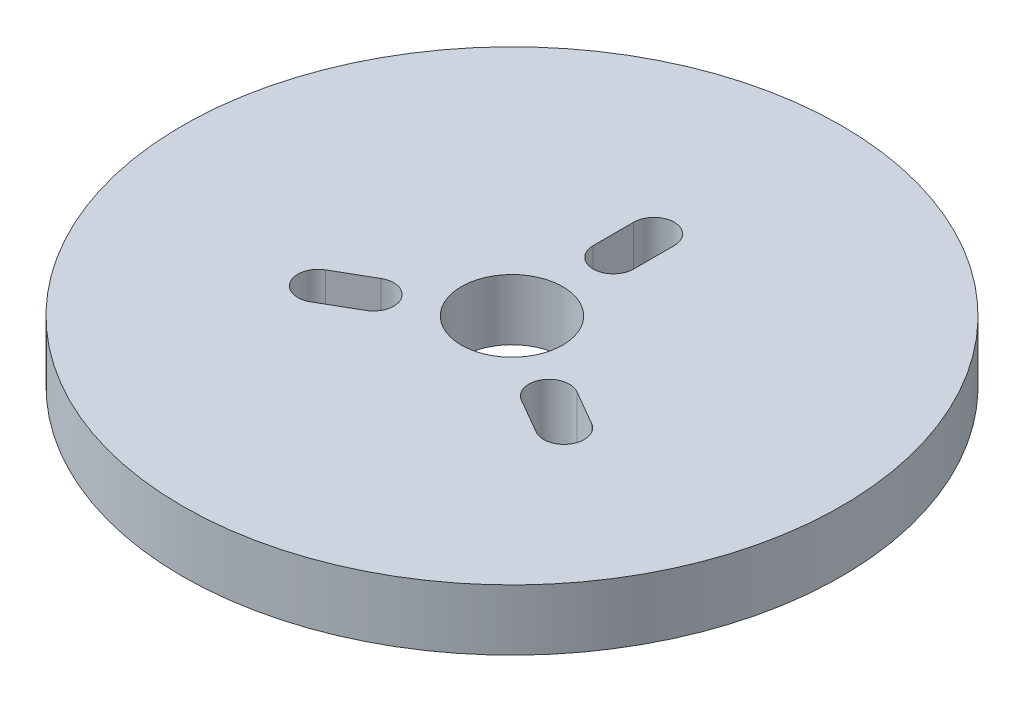
from build123d import *

# Parameters (mm, degrees)
SKETCH1_R           = 32.5
SKETCH1_R_2         = 5
BOSS_EXTRUDE1_DEPTH = 6


with BuildPart() as part:
    # Sketch1 → Boss-Extrude1 (new body)
    with BuildSketch(Plane(origin=(0, 0, 0), x_dir=(1, 0, 0), z_dir=(0, 1, 0))):
        with Locations(Location((0, 0, 0), (0, 0, 270))):
            Circle(SKETCH1_R)
        with Locations(Location((0, 0, 0), (0, 0, 270))):
            Circle(SKETCH1_R_2, mode=Mode.SUBTRACT)
        with BuildLine():
            Line((-2, 10), (-2, 14))
            ThreePointArc((-2, 14), (0, 16), (2, 14))
            Line((2, 14), (2, 10))
            ThreePointArc((2, 10), (0, 8), (-2, 10))
        make_face(mode=Mode.SUBTRACT)
        with BuildLine():
            Line((9.660254038, -3.267949192), (13.124355653, -5.267949192))
            ThreePointArc((13.124355653, -5.267949192), (13.856406461, -8), (11.124355653, -8.732050808))
            Line((11.124355653, -8.732050808), (7.660254038, -6.732050808))
            ThreePointArc((7.660254038, -6.732050808), (6.92820323, -4), (9.660254038, -3.267949192))
        make_face(mode=Mode.SUBTRACT)
        with BuildLine():
            Line((-7.660254038, -6.732050808), (-11.124355653, -8.732050808))
            ThreePointArc((-11.124355653, -8.732050808), (-13.856406461, -8), (-13.124355653, -5.267949192))
            Line((-13.124355653, -5.267949192), (-9.660254038, -3.267949192))
            ThreePointArc((-9.660254038, -3.267949192), (-6.92820323, -4), (-7.660254038, -6.732050808))
        make_face(mode=Mode.SUBTRACT)
    extrude(amount=BOSS_EXTRUDE1_DEPTH)


solid = part.part
